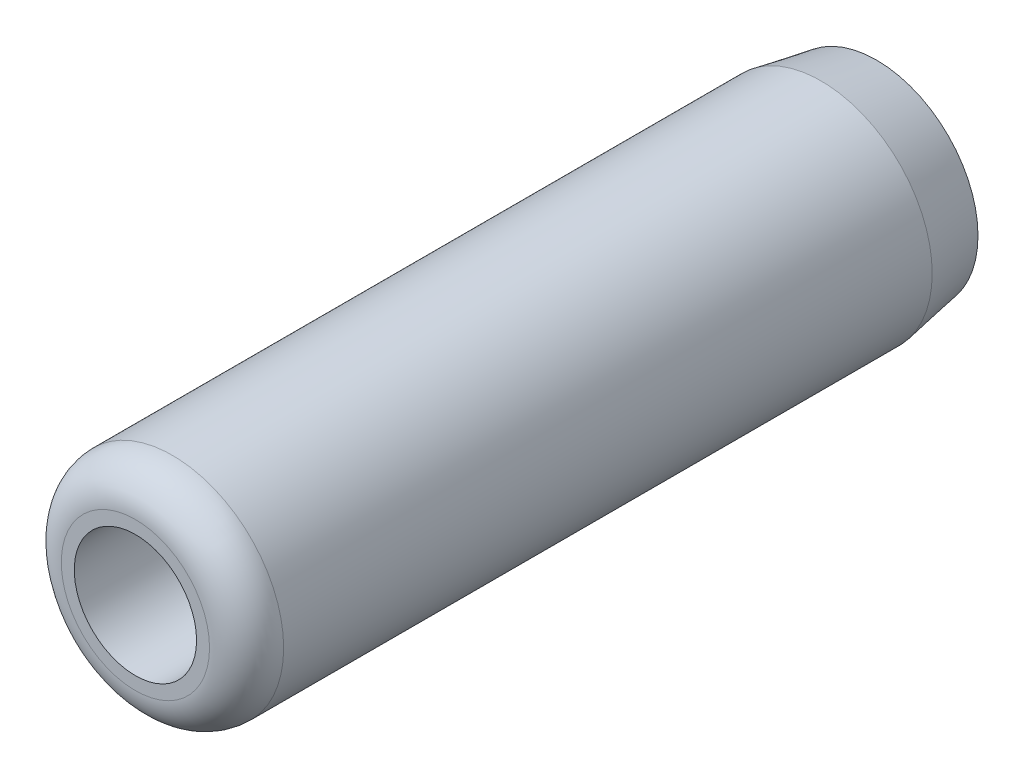
from build123d import *

# Parameters (mm, degrees)
HOLE_WIZARD_M4_1_D = 3.3


with BuildPart() as part:
    # ｽｹｯﾁ1 → 回転1 (revolve)
    with BuildSketch(Plane(origin=(0, 0, 0), x_dir=(0, 0, -1), z_dir=(1, 0, 0)), mode=Mode.PRIVATE) as revolve_1_sk:
        with BuildLine():
            Line((0, 0), (0, 2))
            ThreePointArc((0, 2), (0.292893219, 2.707106781), (1, 3))
            Line((1, 3), (18.5, 3))
            Line((18.5, 3), (20, 2.735509529))
            Line((20, 2.735509529), (20, 0))
            Line((20, 0), (0, 0))
        make_face()
    revolve(revolve_1_sk.sketch.rotate(Axis((0, 0, 0), (0, 0, -1)), 90), axis=Axis((0, 0, 0), (0, 0, -1)))

    # M4 ねじ穴1 (through all)
    with Locations(Plane.XY):
        with Locations((0, 0)):
            Hole(HOLE_WIZARD_M4_1_D / 2)


solid = part.part
